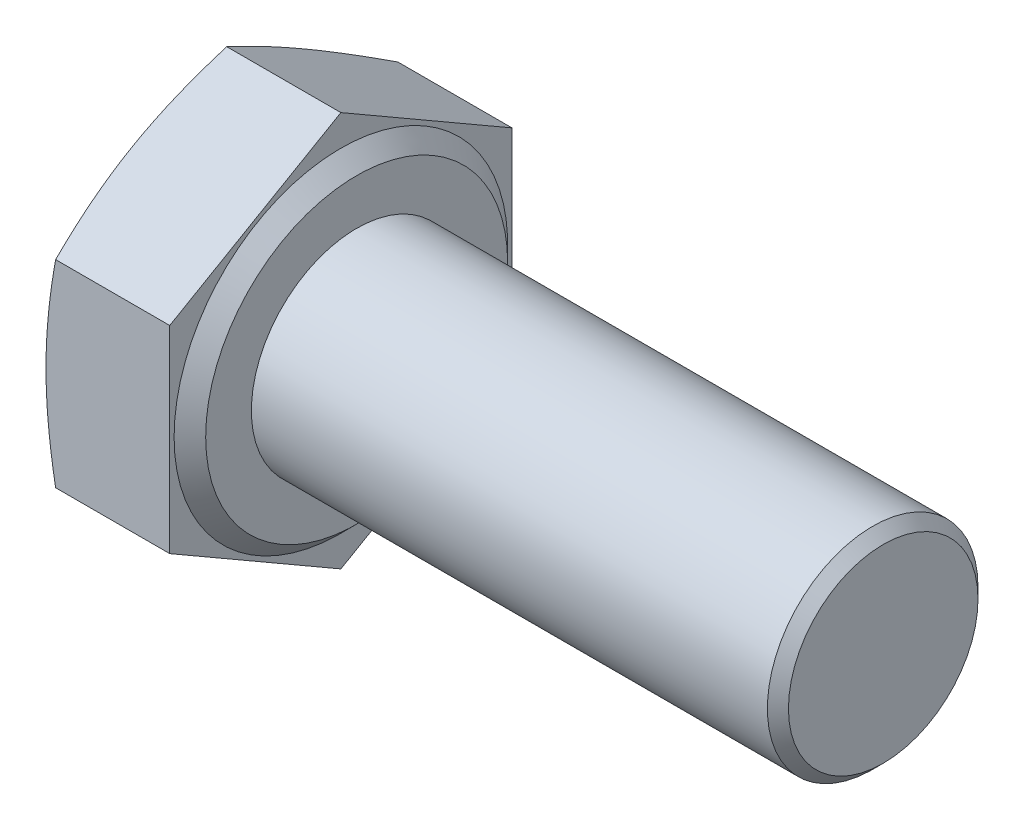
from build123d import *

# Parameters (mm, degrees)
BASEHEAD_DEPTH = 5.3
SKETCH5_R      = 4
BASEBODY_DEPTH = 20
CHAMFER1_SIZE  = 0.4


with BuildPart() as part:
    # Sketch2 → BaseHead (new body)
    with BuildSketch(Plane(origin=(0, 0, 0), x_dir=(0, 0, -1), z_dir=(1, 0, 0))):
        Polygon((0, -7.505553499), (6.5, -3.75277675), (6.5, 3.75277675), (0, 7.505553499), (-6.5, 3.75277675), (-6.5, -3.75277675), align=None)
    extrude(amount=BASEHEAD_DEPTH)

    # Sketch3 → BearingFace (revolve, cut)
    with BuildSketch(Plane.XY, mode=Mode.PRIVATE) as bearingface_sk:
        Polygon((5.3, 7.505553499), (5.3, 5.735), (4.7, 6.335), (4.7, 7.505553499), align=None)
    revolve(bearingface_sk.sketch.rotate(Axis((-0.957090588, 0, 0), (1, 0, 0)), 90), axis=Axis((-0.957090588, 0, 0), (1, 0, 0)), mode=Mode.SUBTRACT)

    # Sketch4 → HeadChamfer (revolve, cut)
    with BuildSketch(Plane.XY):
        Polygon((0, 7.505553499), (0.365991543, 7.505553499), (0, 6.5), align=None)
    revolve(axis=Axis((-0.493528746, 0, 0), (1, 0, 0)), mode=Mode.SUBTRACT)

    # Sketch5 → BaseBody (add)
    with BuildSketch(Plane(origin=(5.3, 0, 0), x_dir=(0, 0, -1), z_dir=(1, 0, 0))):
        Circle(SKETCH5_R)
    extrude(amount=BASEBODY_DEPTH)

    # Chamfer1
    chamfer1_edges = [part.edges().sort_by_distance(p)[0] for p in [
        (25.3, 0, 4),
    ]]
    chamfer(chamfer1_edges, length=CHAMFER1_SIZE)


solid = part.part
